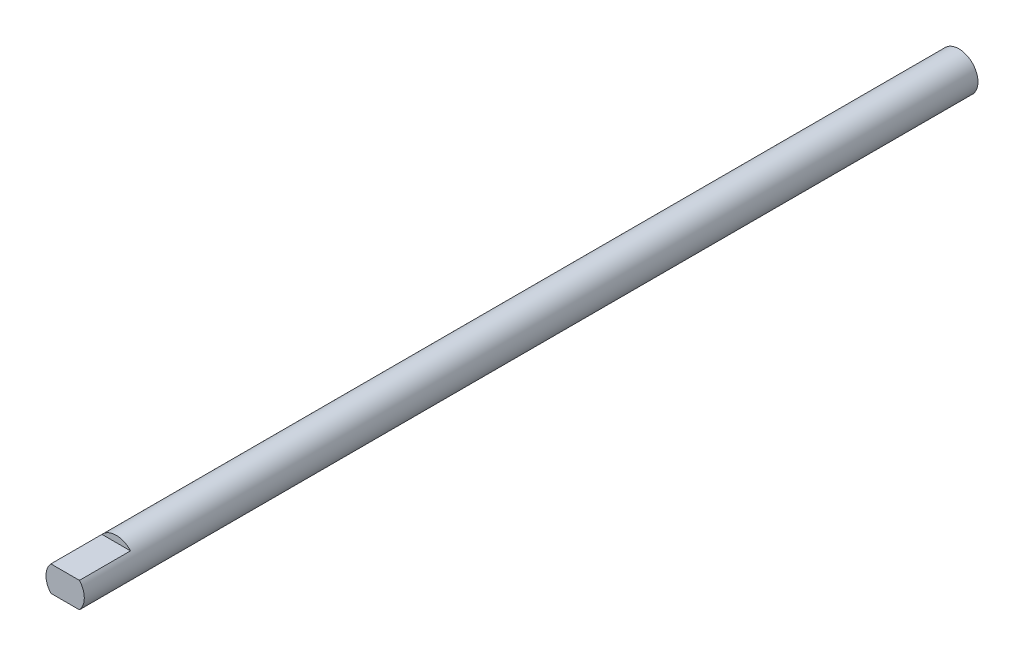
from build123d import *

# Parameters (mm, degrees)
SKETCH_1_R          = 1.5
EXTRUDE_1_DEPTH     = 70
SKETCH_2_W          = 4
SKETCH_2_H          = 1
CUT_EXTRUDE_2_DEPTH = 4


with BuildPart() as part:
    # 草图1 → 凸台-拉伸1 (new body)
    with BuildSketch(Plane.XY):
        Circle(SKETCH_1_R)
    extrude(amount=EXTRUDE_1_DEPTH)

    # 草图2 → 切除-拉伸2 (cut)
    with BuildSketch(Plane.XY.offset(70)):
        with Locations((0.214520216, -1.5)):
            Rectangle(SKETCH_2_W, SKETCH_2_H)
        with Locations((0.214520216, 1.5)):
            Rectangle(SKETCH_2_W, SKETCH_2_H)
    extrude(amount=-CUT_EXTRUDE_2_DEPTH, mode=Mode.SUBTRACT)


solid = part.part
